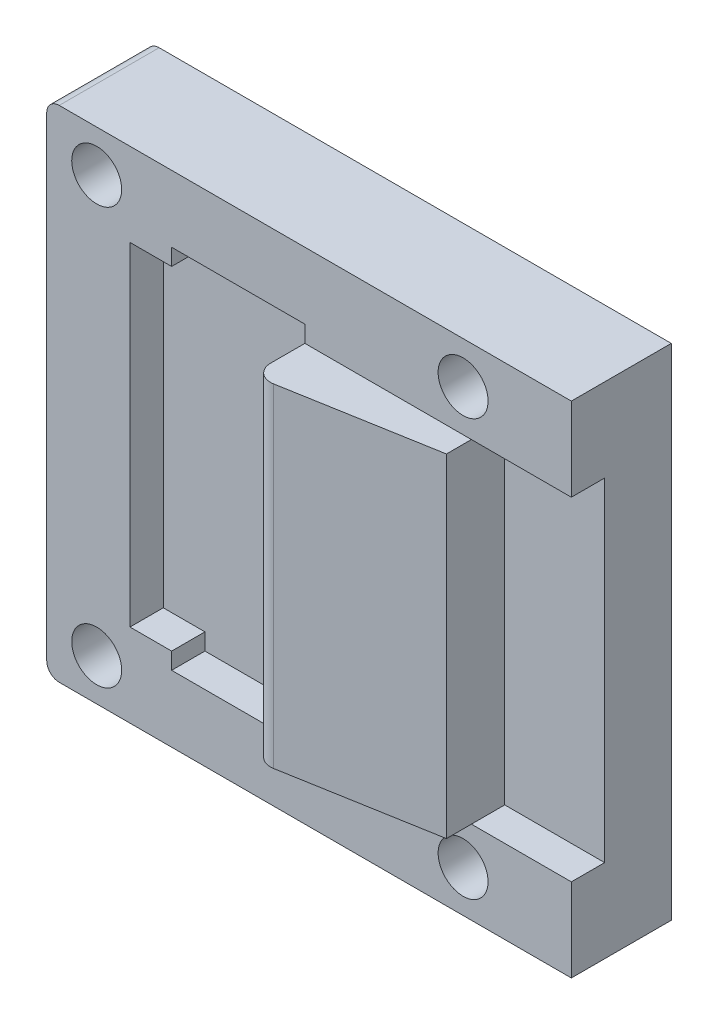
from build123d import *

# Parameters (mm, degrees)
SKETCH1_W                = 30
SKETCH1_H                = 20
BASE_PLATE_DEPTH         = 1
SIDE_WALLS_DEPTH         = 6
SKETCH3_W                = 10
SKETCH3_H                = 20
SWITCH_BLOCK_DEPTH       = 6.5
SKETCH11_W               = 10.5
SKETCH11_H               = 20
SKETCH11_W_2             = 9.5
THICKER_BODY_DEPTH       = 3
SWITCH_BLOCK_ANGLE_DEPTH = 20
SKETCH4_R                = 1.5
M2_SCREWS_DEPTH          = 6
FILLET1_R                = 1
FILLET2_R                = 0.5
FILLET3_R                = 0.5
FILLET4_R                = 0.75
FILLET5_R                = 0.75
SKETCH19_W               = 8
SKETCH19_H               = 22
SPACE_FOR_LEAVER_DEPTH   = 2
SKETCH20_W               = 27.5
SKETCH20_H               = 5
CUT_EXTRUDE1_DEPTH       = 2
CUT_EXTRUDE2_DEPTH       = 26.506893306
CUT_EXTRUDE2_DEPTH_BACK  = 26.506893306
SKETCH21_W               = 20.782145583
SKETCH21_H               = 41.62772639


with BuildPart() as part:
    # Sketch1 → Base Plate (new body)
    with BuildSketch(Plane.XY):
        Rectangle(SKETCH1_W, SKETCH1_H)
    extrude(amount=BASE_PLATE_DEPTH)

    # Sketch2 → Side Walls (add)
    with BuildSketch(Plane(origin=(0, 0, 0), x_dir=(1, 0, 0), z_dir=(0, 0, -1))):
        Polygon((15, 10), (-15, 10), (-15, -10), (15, -10), (15, -15), (-20, -15), (-20, 15), (15, 15), align=None)
    extrude(amount=-SIDE_WALLS_DEPTH)

    # Sketch3 → Switch Block (add)
    with BuildSketch(Plane.XY.offset(1)):
        with Locations((0.5, 0)):
            Rectangle(SKETCH3_W, SKETCH3_H)
    extrude(amount=SWITCH_BLOCK_DEPTH)

    # Sketch11 → Thicker Body (add)
    with BuildSketch(Plane.XY.offset(1)):
        with Locations((-9.75, 0)):
            Rectangle(SKETCH11_W, SKETCH11_H)
        with Locations((10.25, 0)):
            Rectangle(SKETCH11_W_2, SKETCH11_H)
    extrude(amount=THICKER_BODY_DEPTH)

    # Sketch5 → Switch Block Angle (add)
    with BuildSketch(Plane(origin=(0, 10, 0), x_dir=(-1, 0, 0), z_dir=(0, 1, 0))):
        Polygon((4.5, 7.5), (4.5, 9.25), (-5.5, 7.5), align=None)
    extrude(amount=-SWITCH_BLOCK_ANGLE_DEPTH)

    # Sketch4 → M2 Screws (cut)
    with BuildSketch(Plane.XY.offset(6)):
        with Locations((-17, -12.5)):
            Circle(SKETCH4_R)
        with Locations((5, -12.5)):
            Circle(SKETCH4_R)
        with Locations((5, 12.5)):
            Circle(SKETCH4_R)
        with Locations((-17, 12.5)):
            Circle(SKETCH4_R)
    extrude(amount=-M2_SCREWS_DEPTH, mode=Mode.SUBTRACT)

    # Fillet1
    fillet1_edges = [part.edges().sort_by_distance(p)[0] for p in [
        (-4.5, 0, 9.25),
    ]]
    fillet(fillet1_edges, radius=FILLET1_R)

    # Fillet2
    fillet2_edges = [part.edges().sort_by_distance(p)[0] for p in [
        (15, -15, 3),
    ]]
    fillet(fillet2_edges, radius=FILLET2_R)

    # Fillet3
    fillet3_edges = [part.edges().sort_by_distance(p)[0] for p in [
        (15, 15, 3),
    ]]
    fillet(fillet3_edges, radius=FILLET3_R)

    # Fillet4
    fillet4_edges = [part.edges().sort_by_distance(p)[0] for p in [
        (-20, 15, 3),
    ]]
    fillet(fillet4_edges, radius=FILLET4_R)

    # Fillet5
    fillet5_edges = [part.edges().sort_by_distance(p)[0] for p in [
        (-20, -15, 3),
    ]]
    fillet(fillet5_edges, radius=FILLET5_R)

    # Sketch19 → Space for LEaver (cut)
    with BuildSketch(Plane.XY.offset(6)):
        with Locations((-8.5, 0)):
            Rectangle(SKETCH19_W, SKETCH19_H)
    extrude(amount=-SPACE_FOR_LEAVER_DEPTH, mode=Mode.SUBTRACT)

    # Sketch20 → Cut-Extrude1 (cut)
    with BuildSketch(Plane(origin=(0, 0, 0), x_dir=(1, 0, 0), z_dir=(0, 0, -1))):
        with Locations((-6.25, 0)):
            Rectangle(SKETCH20_W, SKETCH20_H)
    extrude(amount=-CUT_EXTRUDE1_DEPTH, mode=Mode.SUBTRACT)

    # Sketch21 → Cut-Extrude2 (cut, two sides: drawn at the far end of the back side and taken through both)
    with BuildSketch(Plane.XY.offset(4).offset(-CUT_EXTRUDE2_DEPTH_BACK)):
        with Locations((21.891072792, -1.973183351)):
            Rectangle(SKETCH21_W, SKETCH21_H)
    extrude(amount=CUT_EXTRUDE2_DEPTH + CUT_EXTRUDE2_DEPTH_BACK, mode=Mode.SUBTRACT)


solid = part.part
